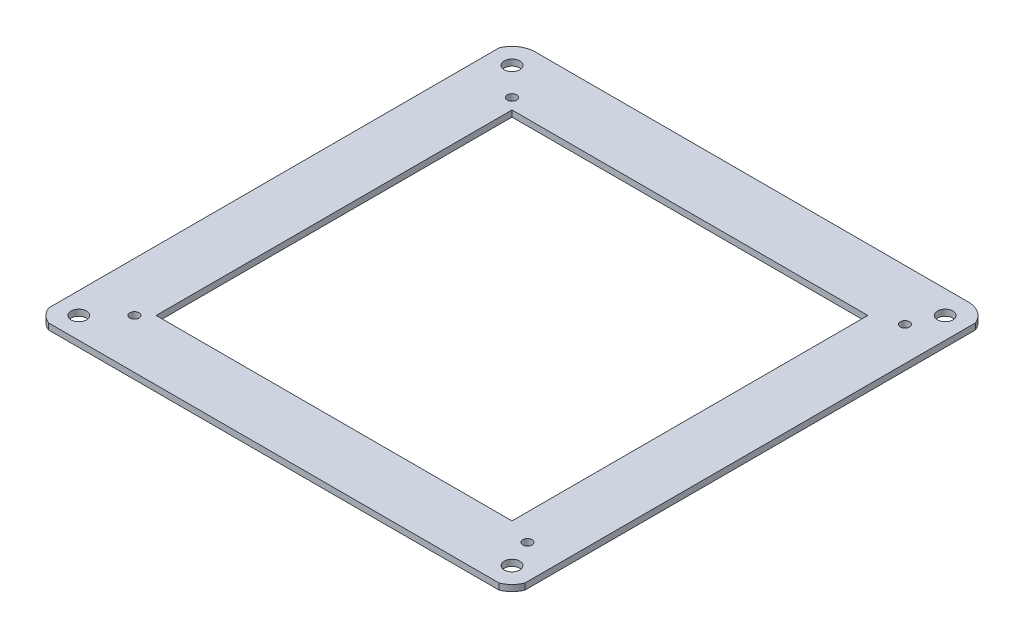
from build123d import *

# Parameters (mm, degrees)
CROQUIS1_W              = 160
CROQUIS1_H              = 160
CROQUIS1_R              = 2.5
CROQUIS1_R_2            = 1.5
CROQUIS1_W_2            = 115
CROQUIS1_H_2            = 115
SALIENTE_EXTRUIR1_DEPTH = 2
CROQUIS3_W              = 170
CROQUIS3_H              = 170
CORTAR_EXTRUIR1_DEPTH   = 10


with BuildPart() as part:
    # Croquis1 → Saliente-Extruir1 (new body)
    with BuildSketch(Plane(origin=(0, 0, 0), x_dir=(1, 0, 0), z_dir=(0, 1, 0))):
        Rectangle(CROQUIS1_W, CROQUIS1_H)
        with Locations(Location((-70, 70, 0), (0, 0, 270))):
            Circle(CROQUIS1_R, mode=Mode.SUBTRACT)
        with Locations(Location((70, 70, 0), (0, 0, 270))):
            Circle(CROQUIS1_R, mode=Mode.SUBTRACT)
        with Locations(Location((70, -70, 0), (0, 0, 270))):
            Circle(CROQUIS1_R, mode=Mode.SUBTRACT)
        with Locations(Location((-70, -70, 0), (0, 0, 270))):
            Circle(CROQUIS1_R, mode=Mode.SUBTRACT)
        with Locations(Location((-61, 61, 0), (0, 0, 270))):
            Circle(CROQUIS1_R_2, mode=Mode.SUBTRACT)
        with Locations(Location((66, 61, 0), (0, 0, 270))):
            Circle(CROQUIS1_R_2, mode=Mode.SUBTRACT)
        with Locations(Location((66, -61, 0), (0, 0, 270))):
            Circle(CROQUIS1_R_2, mode=Mode.SUBTRACT)
        with Locations(Location((-61, -61, 0), (0, 0, 270))):
            Circle(CROQUIS1_R_2, mode=Mode.SUBTRACT)
        Rectangle(CROQUIS1_W_2, CROQUIS1_H_2, mode=Mode.SUBTRACT)
    extrude(amount=SALIENTE_EXTRUIR1_DEPTH)

    # Croquis3 → Cortar-Extruir1 (cut)
    with BuildSketch(Plane(origin=(0, 2, 0), x_dir=(1, 0, 0), z_dir=(0, 1, 0))):
        Rectangle(CROQUIS3_W, CROQUIS3_H)
        with BuildLine():
            Line((72.785430073, -76.963575182), (-72.785430073, -76.963575182))
            ThreePointArc((-72.785430073, -76.963575182), (-75.303300859, -75.303300859), (-76.963575182, -72.785430073))
            Line((-76.963575182, -72.785430073), (-76.963575182, 72.785430073))
            ThreePointArc((-76.963575182, 72.785430073), (-74.20471607, 76.210504229), (-70, 77.5))
            Line((-70, 77.5), (70, 77.5))
            ThreePointArc((70, 77.5), (74.20471607, 76.210504229), (76.963575182, 72.785430073))
            Line((76.963575182, 72.785430073), (76.963575182, -72.785430073))
            ThreePointArc((76.963575182, -72.785430073), (75.303300859, -75.303300859), (72.785430073, -76.963575182))
        make_face(mode=Mode.SUBTRACT)
    extrude(amount=-CORTAR_EXTRUIR1_DEPTH, mode=Mode.SUBTRACT)


solid = part.part
